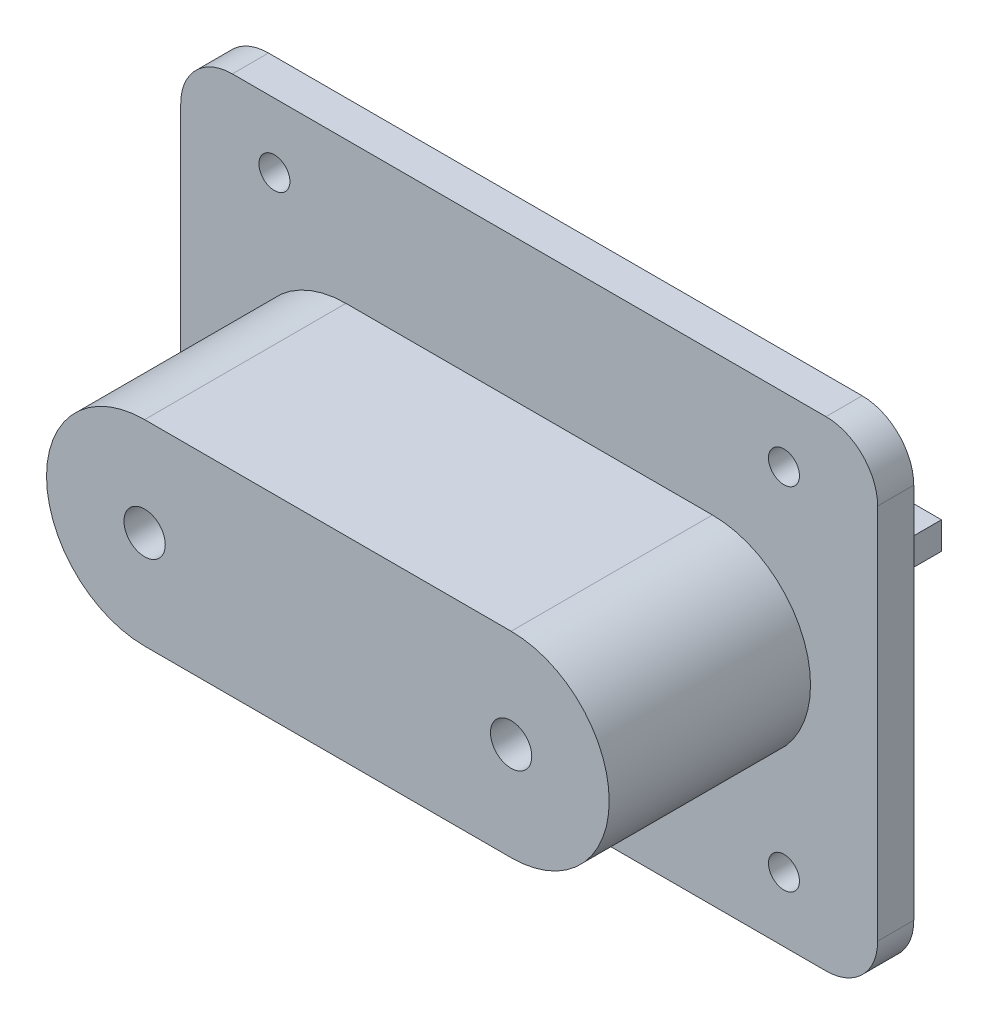
from build123d import *
from build123d.topology import SkipClean

# Parameters (mm, degrees)
SKETCH1_W           = 135
SKETCH1_H           = 93
SKETCH1_R           = 3
BOSS_EXTRUDE1_DEPTH = 7
SKETCH2_R           = 4
BOSS_EXTRUDE2_DEPTH = 39
FILLET1_R           = 10
SKETCH3_R           = 8
BOSS_EXTRUDE3_DEPTH = 8
SKETCH4_W           = 13.352525021
SKETCH4_H           = 5.289406047
BOSS_EXTRUDE4_DEPTH = 23
SKETCH5_R           = 4
CUT_EXTRUDE1_DEPTH  = 23
BOSS_EXTRUDE5_START = 4
SKETCH6_R           = 8.5
SKETCH6_R_2         = 6
SKETCH6_R_3         = 3
BOSS_EXTRUDE5_DEPTH = 4


with BuildPart() as part:
    # Sketch1 → Boss-Extrude1 (new body)
    with BuildSketch(Plane.XY):
        Rectangle(SKETCH1_W, SKETCH1_H)
        with Locations((-49.35483871, 34)):
            Circle(SKETCH1_R, mode=Mode.SUBTRACT)
        with Locations((49.35483871, 34)):
            Circle(SKETCH1_R, mode=Mode.SUBTRACT)
        with Locations((-49.35483871, -34)):
            Circle(SKETCH1_R, mode=Mode.SUBTRACT)
        with Locations((49.35483871, -34)):
            Circle(SKETCH1_R, mode=Mode.SUBTRACT)
    extrude(amount=BOSS_EXTRUDE1_DEPTH)

    # Sketch2 → Boss-Extrude2 (add)
    with BuildSketch(Plane.XY.offset(7)):
        with BuildLine():
            Line((-35.5, 19), (35.5, 19))
            ThreePointArc((35.5, 19), (54.5, 0), (35.5, -19))
            Line((35.5, -19), (-35.5, -19))
            ThreePointArc((-35.5, -19), (-54.5, 0), (-35.5, 19))
        make_face()
        with Locations((-35.5, 0)):
            Circle(SKETCH2_R, mode=Mode.SUBTRACT)
        with Locations((35.5, 0)):
            Circle(SKETCH2_R, mode=Mode.SUBTRACT)
    extrude(amount=BOSS_EXTRUDE2_DEPTH)

    # Fillet1
    fillet1_edges = [part.edges().sort_by_distance(p)[0] for p in [
        (-67.5, -46.5, 3.5),
        (-67.5, 46.5, 3.5),
        (67.5, 46.5, 3.5),
        (67.5, -46.5, 3.5),
    ]]
    fillet(fillet1_edges, radius=FILLET1_R)

    # Sketch3 → Boss-Extrude3 (add)
    with BuildSketch(Plane(origin=(0, 0, 0), x_dir=(-1, 0, 0), z_dir=(0, 0, -1))):
        with Locations(Location((-35.5, 0, 0), (0, 0, 180))):
            Circle(SKETCH3_R)
        with Locations(Location((35.5, 0, 0), (0, 0, 180))):
            Circle(SKETCH3_R)
    extrude(amount=BOSS_EXTRUDE3_DEPTH)

    # Sketch4 → Boss-Extrude4 (add)
    with BuildSketch(Plane(origin=(0, 0, -8), x_dir=(-1, 0, 0), z_dir=(0, 0, -1))):
        with Locations((-35.191522183, -0.266454552)):
            Rectangle(SKETCH4_W, SKETCH4_H)
        with Locations((35.191522183, -0.266454552)):
            Rectangle(SKETCH4_W, SKETCH4_H)
    extrude(amount=BOSS_EXTRUDE4_DEPTH)

    # Sketch5 → Cut-Extrude1 (cut)
    with BuildSketch(Plane(origin=(0, 2.378248472, 0), x_dir=(1, 0, 0), z_dir=(0, 1, 0))):
        with Locations(Location((35.191522184, 22.89088314, 0), (0, 0, 270))):
            Circle(SKETCH5_R)
        with Locations(Location((-35.191522184, 22.89088314, 0), (0, 0, 270))):
            Circle(SKETCH5_R)
    extrude(amount=-CUT_EXTRUDE1_DEPTH, mode=Mode.SUBTRACT)

    # Sketch6 → Boss-Extrude5 (add)
    # profile 1 of 4: a face of its own
    with SkipClean():  # the faces are left unmerged after this step: merging them gives an invalid solid
        with BuildSketch(Plane(origin=(0, 0, 0), x_dir=(-1, 0, 0), z_dir=(0, 0, -1)).offset(BOSS_EXTRUDE5_START)):
            with Locations(Location((-49.35483871, 34, 0), (0, 0, 180))):
                Circle(SKETCH6_R)
            with Locations((-49.35483871, 34)):
                Circle(SKETCH6_R_2, mode=Mode.SUBTRACT)
        # profile 2 of 4: a face of its own
        with BuildSketch(Plane(origin=(0, 0, 0), x_dir=(-1, 0, 0), z_dir=(0, 0, -1)).offset(BOSS_EXTRUDE5_START)):
            with Locations((-49.35483871, -34)):
                Circle(SKETCH6_R)
            with Locations((-49.35483871, -34)):
                Circle(SKETCH6_R_3, mode=Mode.SUBTRACT)
        # profile 3 of 4: a face of its own
        with BuildSketch(Plane(origin=(0, 0, 0), x_dir=(-1, 0, 0), z_dir=(0, 0, -1)).offset(BOSS_EXTRUDE5_START)):
            with Locations(Location((49.35483871, -34, 0), (0, 0, 180))):
                Circle(SKETCH6_R)
            with Locations((49.35483871, -34)):
                Circle(SKETCH6_R_3, mode=Mode.SUBTRACT)
        # profile 4 of 4: a face of its own
        with BuildSketch(Plane(origin=(0, 0, 0), x_dir=(-1, 0, 0), z_dir=(0, 0, -1)).offset(BOSS_EXTRUDE5_START)):
            with Locations((49.35483871, 34)):
                Circle(SKETCH6_R)
            with Locations((49.35483871, 34)):
                Circle(SKETCH6_R_3, mode=Mode.SUBTRACT)
        extrude(amount=-BOSS_EXTRUDE5_DEPTH)


solid = part.part
